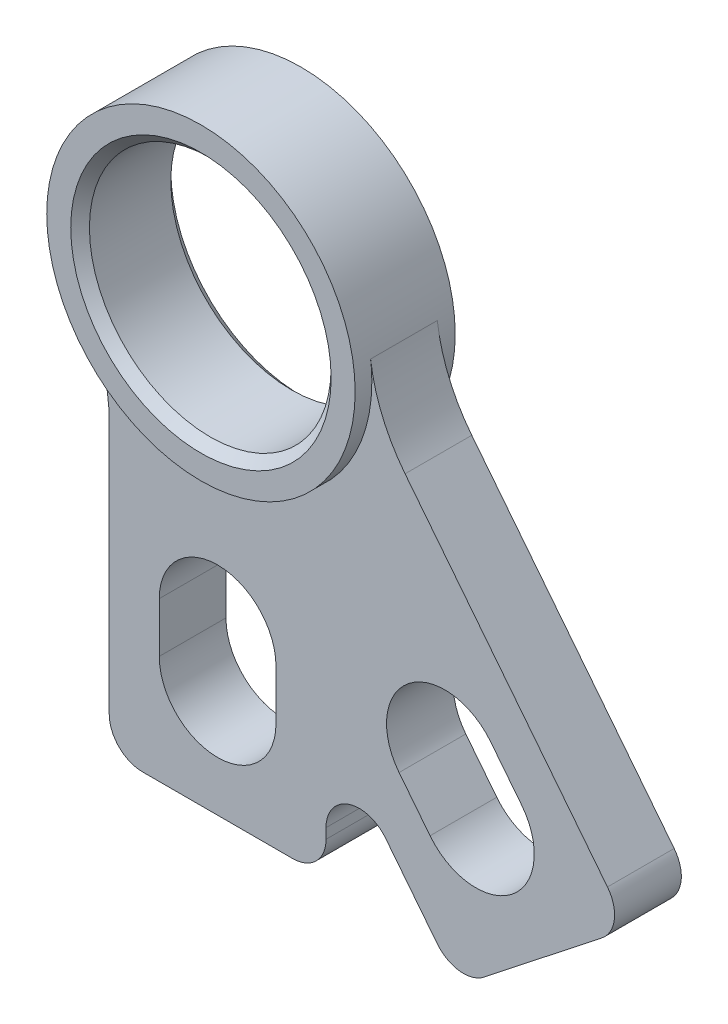
from build123d import *

# Parameters (mm, degrees)
SKETCH1_R           = 11.5062
BOSS_EXTRUDE2_DEPTH = 4.7625
BOSS_EXTRUDE3_DEPTH = 3.175
FILLET1_R           = 3.175
CHAMFER1_SIZE       = 0.889


with BuildPart() as part:
    # Sketch1 → Boss-Extrude2 (new, symmetric)
    with BuildSketch(Plane.XY):
        with BuildLine():
            ThreePointArc((14.563243761, 1.857300354), (-4.811299793, 13.870437187), (-12.585193267, -7.559797873))
            ThreePointArc((-12.585193267, -7.559797873), (4.811299793, -13.870437187), (14.563243761, 1.857300354))
        make_face()
        Circle(SKETCH1_R, mode=Mode.SUBTRACT)
    extrude(amount=BOSS_EXTRUDE2_DEPTH, both=True)

    # Sketch1<4> → Boss-Extrude3 (add, symmetric)
    with BuildSketch(Plane.XY):
        with BuildLine():
            ThreePointArc((-12.585193267, -7.559797873), (-10.89585042, -11.492870345), (-10.31875, -15.734319794))
            Line((-10.31875, -15.734319794), (-10.31875, -43.039319794))
            Line((-10.31875, -43.039319794), (10.31875, -43.039319794))
            Line((10.31875, -43.039319794), (10.31875, -29.747797869))
            Line((10.31875, -29.747797869), (22.874796512, -45.668948499))
            Line((22.874796512, -45.668948499), (39.079387582, -32.889369691))
            Line((39.079387582, -32.889369691), (17.84562587, -5.964818374))
            ThreePointArc((17.84562587, -5.964818374), (15.672287957, -2.277062873), (14.563243761, 1.857300354))
            ThreePointArc((14.563243761, 1.857300354), (4.811299793, -13.870437187), (-12.585193267, -7.559797873))
        make_face()
        with BuildLine():
            ThreePointArc((5.55625, -32.720569794), (0, -38.276819794), (-5.55625, -32.720569794))
            Line((-5.55625, -32.720569794), (-5.55625, -27.958069794))
            ThreePointArc((-5.55625, -27.958069794), (0, -22.401819794), (5.55625, -27.958069794))
            Line((5.55625, -27.958069794), (5.55625, -32.720569794))
        make_face(mode=Mode.SUBTRACT)
        with BuildLine():
            ThreePointArc((28.950077162, -27.736207727), (28.027958476, -35.539638078), (20.224528124, -34.617519392))
            Line((20.224528124, -34.617519392), (17.275394553, -30.877998376))
            ThreePointArc((17.275394553, -30.877998376), (18.197513239, -23.074568025), (26.000943591, -23.996686711))
            Line((26.000943591, -23.996686711), (28.950077162, -27.736207727))
        make_face(mode=Mode.SUBTRACT)
    extrude(amount=BOSS_EXTRUDE3_DEPTH, both=True)

    # Fillet1
    fillet1_edges = [part.edges().sort_by_distance(p)[0] for p in [
        (-10.31875, -43.039319794, 0),
        (39.079387582, -32.889369691, 0),
        (10.31875, -43.039319794, 0),
        (22.874796512, -45.668948499, 0),
        (10.31875, -29.747797869, 0),
    ]]
    fillet(fillet1_edges, radius=FILLET1_R)

    # Chamfer1
    chamfer1_edges = [part.edges().sort_by_distance(p)[0] for p in [
        (-11.5062, 0, -4.7625),
        (-11.5062, 0, 4.7625),
    ]]
    chamfer(chamfer1_edges, length=CHAMFER1_SIZE)


solid = part.part
